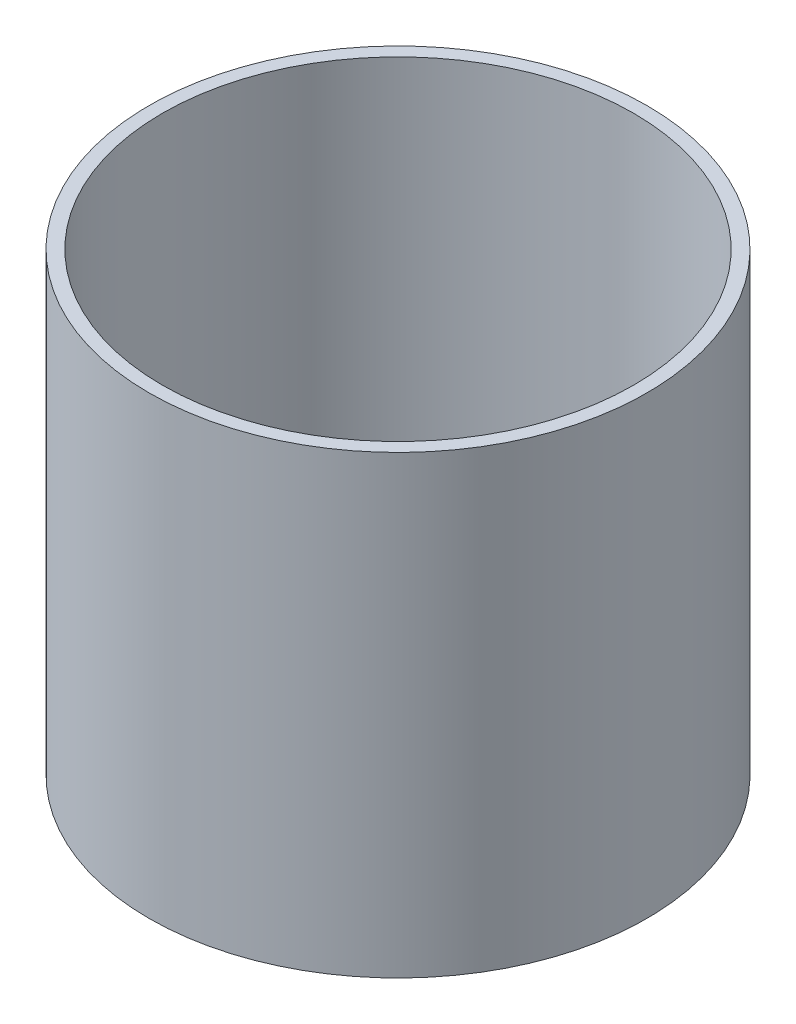
from build123d import *

# Parameters (mm, degrees)
CROQUIS1_R            = 70
CROQUIS1_R_2          = 66.25
EXTRUIR_L_MINA1_DEPTH = 128


with BuildPart() as part:
    # Croquis1 → Extruir-Lámina1 (new body)
    with BuildSketch(Plane(origin=(0, 0, 0), x_dir=(1, 0, 0), z_dir=(0, 1, 0))):
        Circle(CROQUIS1_R)
        Circle(CROQUIS1_R_2, mode=Mode.SUBTRACT)
    extrude(amount=EXTRUIR_L_MINA1_DEPTH)


solid = part.part
